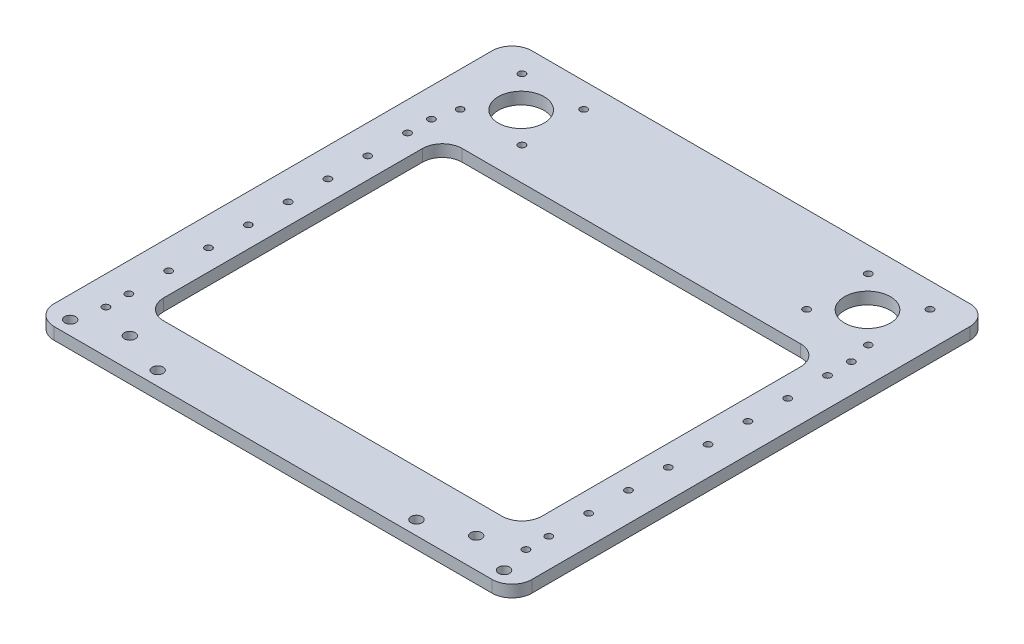
from build123d import *

# Parameters (mm, degrees)
SKETCH1_W           = 240
SKETCH1_H           = 240
BOSS_EXTRUDE1_DEPTH = 6
SKETCH2_R           = 1.75
CUT_EXTRUDE1_DEPTH  = 170.811660377
SKETCH4_R           = 2.75
CUT_EXTRUDE2_DEPTH  = 170.811660377
SKETCH5_W           = 190
SKETCH5_H           = 150
CUT_EXTRUDE3_DEPTH  = 170.811660377
SKETCH6_R           = 11.5
CUT_EXTRUDE4_DEPTH  = 170.811660377
SKETCH9_R           = 2.75
CUT_EXTRUDE7_DEPTH  = 10
CUT_EXTRUDE8_DEPTH  = 10
SKETCH11_R          = 1.75
CUT_EXTRUDE9_DEPTH  = 10
FILLET1_R           = 10


with BuildPart() as part:
    # Sketch1 → Boss-Extrude1 (new body)
    with BuildSketch(Plane(origin=(0, 0, 0), x_dir=(1, 0, 0), z_dir=(0, 1, 0))):
        Rectangle(SKETCH1_W, SKETCH1_H)
    extrude(amount=BOSS_EXTRUDE1_DEPTH)

    # Sketch2 → Cut-Extrude1 (cut, through all)
    with BuildSketch(Plane(origin=(0, 6, 0), x_dir=(1, 0, 0), z_dir=(0, 1, 0))):
        with Locations((105.5, 53)):
            Circle(SKETCH2_R)
        with Locations((71.5, 107.5)):
            Circle(SKETCH2_R)
        with Locations((102.5, 107.5)):
            Circle(SKETCH2_R)
        with Locations((71.5, 76.5)):
            Circle(SKETCH2_R)
        with Locations((102.5, 76.5)):
            Circle(SKETCH2_R)
        with Locations((105.5, 33)):
            Circle(SKETCH2_R)
        with Locations((105.5, 13)):
            Circle(SKETCH2_R)
        with Locations((105.5, -7)):
            Circle(SKETCH2_R)
        with Locations((105.5, -27)):
            Circle(SKETCH2_R)
        with Locations((105.5, -47)):
            Circle(SKETCH2_R)
        with Locations((105.5, -67)):
            Circle(SKETCH2_R)
        with Locations((105.5, -87)):
            Circle(SKETCH2_R)
    cut_extrude1 = extrude(amount=-CUT_EXTRUDE1_DEPTH, mode=Mode.SUBTRACT)

    # Mirror1: Cut-Extrude1 across plane
    add(cut_extrude1.mirror(Plane(origin=(0, 0, 0), x_dir=(0, 0, 1), z_dir=(1, 0, 0))), mode=Mode.SUBTRACT)

    # Sketch4 → Cut-Extrude2 (cut, through all)
    with BuildSketch(Plane(origin=(0, 6, 0), x_dir=(1, 0, 0), z_dir=(0, 1, 0))):
        with Locations((-87, -105)):
            Circle(SKETCH4_R)
    cut_extrude2 = extrude(amount=-CUT_EXTRUDE2_DEPTH, mode=Mode.SUBTRACT)

    # Mirror2: Cut-Extrude2 across plane
    add(cut_extrude2.mirror(Plane(origin=(0, 0, 0), x_dir=(0, 0, 1), z_dir=(1, 0, 0))), mode=Mode.SUBTRACT)

    # Sketch5 → Cut-Extrude3 (cut, through all)
    with BuildSketch(Plane(origin=(0, 6, 0), x_dir=(1, 0, 0), z_dir=(0, 1, 0))):
        with Locations((0, -15)):
            Rectangle(SKETCH5_W, SKETCH5_H)
    extrude(amount=-CUT_EXTRUDE3_DEPTH, mode=Mode.SUBTRACT)

    # Sketch6 → Cut-Extrude4 (cut, through all)
    with BuildSketch(Plane(origin=(0, 6, 0), x_dir=(1, 0, 0), z_dir=(0, 1, 0))):
        with Locations((-87, 91.6)):
            Circle(SKETCH6_R)
    cut_extrude4 = extrude(amount=-CUT_EXTRUDE4_DEPTH, mode=Mode.SUBTRACT)

    # Mirror3: Cut-Extrude4 across plane
    add(cut_extrude4.mirror(Plane(origin=(0, 0, 0), x_dir=(0, 0, 1), z_dir=(1, 0, 0))), mode=Mode.SUBTRACT)

    # Sketch9 → Cut-Extrude7 (cut)
    with BuildSketch(Plane(origin=(0, 6, 0), x_dir=(1, 0, 0), z_dir=(0, 1, 0))):
        with Locations((-109, -113)):
            Circle(SKETCH9_R)
        with Locations((-65, -113)):
            Circle(SKETCH9_R)
        with Locations((65, -113)):
            Circle(SKETCH9_R)
        with Locations((109, -113)):
            Circle(SKETCH9_R)
    extrude(amount=-CUT_EXTRUDE7_DEPTH, mode=Mode.SUBTRACT)

    # Sketch10 → Cut-Extrude8 (cut)
    with BuildSketch(Plane(origin=(0, 6, 0), x_dir=(1, 0, 0), z_dir=(0, 1, 0))):
        with BuildLine():
            ThreePointArc((-105.5, 63.25), (-104.262563133, 63.762563133), (-103.75, 65))
            ThreePointArc((-103.75, 65), (-106.737436867, 66.237436867), (-105.5, 63.25))
        make_face()
    cut_extrude8 = extrude(amount=-CUT_EXTRUDE8_DEPTH, mode=Mode.SUBTRACT)

    # Mirror4: Cut-Extrude8 across plane
    add(cut_extrude8.mirror(Plane(origin=(0, 0, 0), x_dir=(0, 0, 1), z_dir=(1, 0, 0))), mode=Mode.SUBTRACT)

    # Sketch11 → Cut-Extrude9 (cut)
    with BuildSketch(Plane(origin=(0, 6, 0), x_dir=(1, 0, 0), z_dir=(0, 1, 0))):
        with Locations((-105.5, -98.5)):
            Circle(SKETCH11_R)
    cut_extrude9 = extrude(amount=-CUT_EXTRUDE9_DEPTH, mode=Mode.SUBTRACT)

    # Mirror6: Cut-Extrude9 across plane
    add(cut_extrude9.mirror(Plane(origin=(0, 0, 0), x_dir=(0, 0, 1), z_dir=(1, 0, 0))), mode=Mode.SUBTRACT)

    # Fillet1
    fillet1_edges = [part.edges().sort_by_distance(p)[0] for p in [
        (120, 3, -120),
        (-120, 3, -120),
        (-120, 3, 120),
        (120, 3, 120),
        (-95, 3, -60),
        (-95, 3, 90),
        (95, 3, 90),
        (95, 3, -60),
    ]]
    fillet(fillet1_edges, radius=FILLET1_R)


solid = part.part
